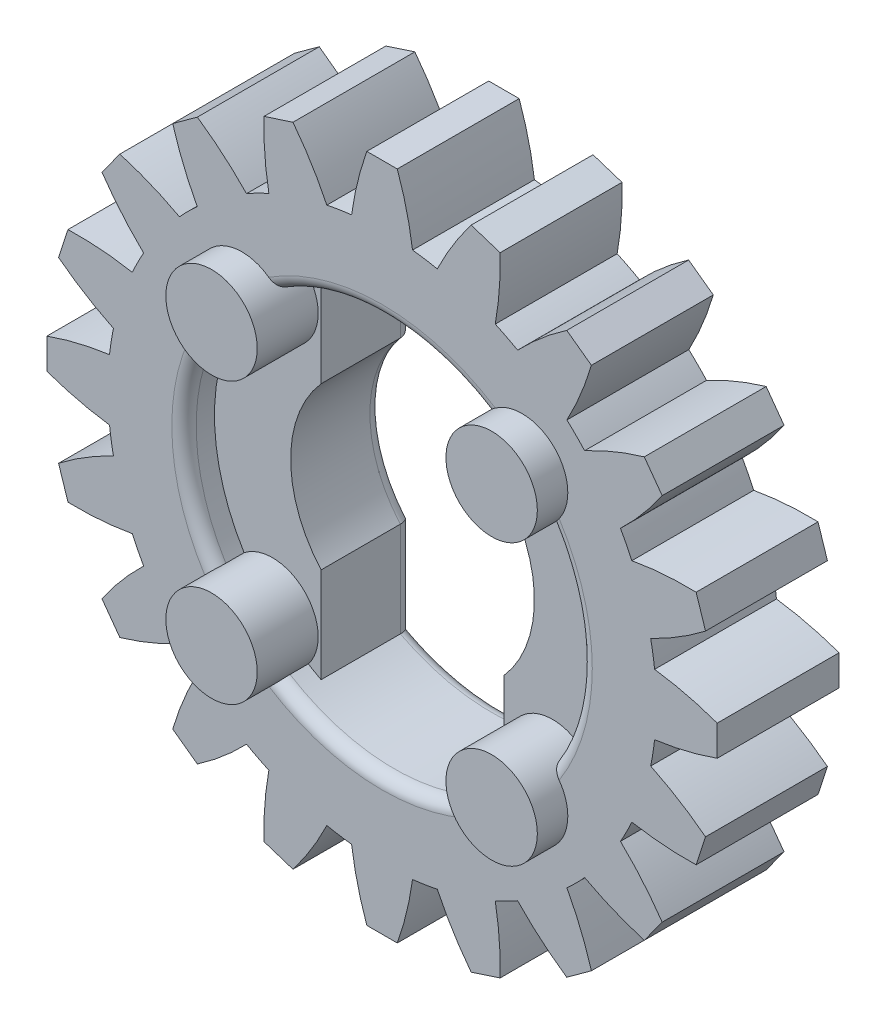
from build123d import *

# Parameters (mm, degrees)
SKETCH_1_R           = 4.500000000000001
EXTRUDE_1_DEPTH      = 2
SKETCH_4_R           = 3.250000000000001
CUT_EXTRUDE_3_DEPTH  = 0.5
CUT_EXTRUDE_1_DEPTH  = 7.670832032063168
EXTRUDE_START        = -2
EXTRUDE_2_DEPTH      = 2
FILLET_1_R           = 0.2
EXTRUDE_3_DEPTH      = 0.5
EXTRUDE_3_DEPTH_BACK = 1
SKETCH_5_R           = 0.7500000000000001
SKETCH_5_R_2         = 0.7500000000001326
SKETCH_5_R_3         = 0.7500000000001795
SKETCH_5_R_4         = 0.750000000000069


with BuildPart() as part:
    # 草图1 → 凸台-拉伸1 (new body)
    with BuildSketch(Plane.XY):
        Circle(SKETCH_1_R)
    extrude(amount=EXTRUDE_1_DEPTH)

    # 草图4 → 切除-拉伸3 (cut)
    with BuildSketch(Plane.XY.offset(2)):
        Circle(SKETCH_4_R)
    extrude(amount=-CUT_EXTRUDE_3_DEPTH, mode=Mode.SUBTRACT)

    # 草图3 → 切除-拉伸1 (cut, through all)
    with BuildSketch(Plane.XY.offset(2)):
        with BuildLine():
            Line((-1.4999999999999991, -1.322875655532296), (-1.4999999999999993, -2.8831406486676996))
            ThreePointArc((-1.4999999999999993, -2.8831406486676996), (9.2e-16, -3.2500000000000004), (1.5000000000000007, -2.883140648667699))
            Line((1.5000000000000007, -2.883140648667699), (1.5000000000000004, -1.3228756555322945))
            ThreePointArc((1.5000000000000004, -1.3228756555322945), (1.9999999999999998, 2.2e-16), (1.5000000000000004, 1.322875655532295))
            Line((1.5000000000000004, 1.322875655532295), (1.5000000000000002, 2.883140648667699))
            ThreePointArc((1.5000000000000002, 2.883140648667699), (2e-16, 3.2500000000000004), (-1.4999999999999998, 2.8831406486676996))
            Line((-1.4999999999999998, 2.8831406486676996), (-1.4999999999999991, 1.3228756555322956))
            ThreePointArc((-1.4999999999999991, 1.3228756555322956), (-1.9999999999999996, 2.4e-16), (-1.4999999999999991, -1.322875655532296))
        make_face()
    extrude(amount=-CUT_EXTRUDE_1_DEPTH, mode=Mode.SUBTRACT)

    # 草图2 → 凸台-拉伸2 (add)
    with BuildSketch(Plane.XY.offset(2).offset(EXTRUDE_START)):
        with BuildLine():
            Line((1.9373575981598865, 5.153556591021841), (1.4618293399884268, 5.308065088217082))
            ThreePointArc((1.4618293399884268, 5.308065088217082), (1.1606520267352467, 4.872399431289981), (0.9064377531025313, 4.407762538947674))
            ThreePointArc((0.9064377531025313, 4.407762538947674), (1.3905764746872666, 4.27975432332819), (1.8574942693976855, 4.098745544572725))
            ThreePointArc((1.8574942693976855, 4.098745544572725), (1.9249373148175617, 4.62406808765027), (1.9373575981598865, 5.153556591021841))
        make_face()
        with BuildLine():
            Line((3.435073136222657, 4.302647155974325), (3.0305646390148726, 4.596539782135326))
            ThreePointArc((3.0305646390148726, 4.596539782135326), (2.6094999008291686, 4.275266028304218), (2.2241470634082, 3.9119266148961294))
            ThreePointArc((2.2241470634082, 3.9119266148961294), (2.6450336353161346, 3.640576474687261), (3.033164057783147, 3.3241413626036542))
            ThreePointArc((3.033164057783147, 3.3241413626036542), (3.2596397989477355, 3.802911743167154), (3.435073136222657, 4.302647155974325))
        make_face()
        with BuildLine():
            Line((4.5965397821500895, 3.030564638994542), (4.3026471559891, 3.4350731362023295))
            ThreePointArc((4.3026471559891, 3.4350731362023295), (3.8029117431750286, 3.259639798938069), (3.324141362603664, 3.033164057783135))
            ThreePointArc((3.324141362603664, 3.033164057783135), (3.6405764746872684, 2.645033635316121), (3.911926614896136, 2.2241470634081852))
            ThreePointArc((3.911926614896136, 2.2241470634081852), (4.2752660283109725, 2.6094999008186957), (4.5965397821500895, 3.030564638994542))
        make_face()
        with BuildLine():
            Line((5.30806508822484, 1.4618293399645328), (5.1535565910296155, 1.9373575981359852))
            ThreePointArc((5.1535565910296155, 1.9373575981359852), (4.624068087654777, 1.9249373148059337), (4.098745544572733, 1.8574942693976708))
            ThreePointArc((4.098745544572733, 1.8574942693976708), (4.279754323328198, 1.3905764746872515), (4.407762538947678, 0.9064377531025155))
            ThreePointArc((4.407762538947678, 0.9064377531025155), (4.87239943129317, 1.160652026723203), (5.30806508822484, 1.4618293399645328))
        make_face()
        with BuildLine():
            Line((0.25000000002511774, 5.499999999999996), (-0.25, 5.500000000000001))
            ThreePointArc((-0.25, 5.500000000000001), (-0.40180855447370334, 4.9925884299380545), (-0.5000000000000003, 4.472135954999579))
            ThreePointArc((-0.5000000000000003, 4.472135954999579), (2.8e-16, 4.499999999999999), (0.5000000000000003, 4.472135954999579))
            ThreePointArc((0.5000000000000003, 4.472135954999579), (0.4018085544861396, 4.9925884299373635), (0.25000000002511774, 5.499999999999996))
        make_face()
        with BuildLine():
            Line((5.499999999999996, -0.2500000000251174), (5.500000000000002, 0.24999999999998082))
            ThreePointArc((5.500000000000002, 0.24999999999998082), (4.9925884299380545, 0.4018085544736856), (4.4721359549995805, 0.49999999999998473))
            ThreePointArc((4.4721359549995805, 0.49999999999998473), (4.499999999999999, -1.567e-14), (4.472135954999577, -0.500000000000016))
            ThreePointArc((4.472135954999577, -0.500000000000016), (4.992588429937362, -0.4018085544861396), (5.499999999999996, -0.2500000000251174))
        make_face()
        with BuildLine():
            Line((5.153556591021841, -1.9373575981598858), (5.308065088217076, -1.4618293399884452))
            ThreePointArc((5.308065088217076, -1.4618293399884452), (4.872399431289976, -1.1606520267352636), (4.4077625389476704, -0.9064377531025464))
            ThreePointArc((4.4077625389476704, -0.9064377531025464), (4.279754323328185, -1.3905764746872815), (4.098745544572718, -1.8574942693976995))
            ThreePointArc((4.098745544572718, -1.8574942693976995), (4.624068087650268, -1.9249373148175613), (5.153556591021841, -1.9373575981598858))
        make_face()
        with BuildLine():
            Line((4.302647155974325, -3.435073136222657), (4.596539782135315, -3.0305646390148873))
            ThreePointArc((4.596539782135315, -3.0305646390148873), (4.275266028304208, -2.6094999008291833), (3.9119266148961214, -2.224147063408212))
            ThreePointArc((3.9119266148961214, -2.224147063408212), (3.640576474687251, -2.645033635316146), (3.324141362603644, -3.033164057783157))
            ThreePointArc((3.324141362603644, -3.033164057783157), (3.8029117431671526, -3.2596397989477346), (4.302647155974325, -3.435073136222657))
        make_face()
        with BuildLine():
            Line((3.0305646389945426, -4.596539782150089), (3.4350731362023152, -4.302647155989114))
            ThreePointArc((3.4350731362023152, -4.302647155989114), (3.259639798938057, -3.8029117431750414), (3.033164057783123, -3.3241413626036764))
            ThreePointArc((3.033164057783123, -3.3241413626036764), (2.6450336353161084, -3.6405764746872795), (2.2241470634081715, -3.911926614896146))
            ThreePointArc((2.2241470634081715, -3.911926614896146), (2.6094999008186957, -4.275266028310971), (3.0305646389945426, -4.596539782150089))
        make_face()
        with BuildLine():
            Line((1.461829339964533, -5.30806508822484), (1.9373575981359654, -5.153556591029619))
            ThreePointArc((1.9373575981359654, -5.153556591029619), (1.9249373148059155, -4.62406808765478), (1.8574942693976553, -4.098745544572736))
            ThreePointArc((1.8574942693976553, -4.098745544572736), (1.3905764746872344, -4.2797543233281985), (0.906437753102499, -4.4077625389476776))
            ThreePointArc((0.906437753102499, -4.4077625389476776), (1.1606520267232003, -4.872399431293165), (1.461829339964533, -5.30806508822484))
        make_face()
        with BuildLine():
            Line((-0.2500000000251171, -5.499999999999996), (0.24999999999996161, -5.500000000000003))
            ThreePointArc((0.24999999999996161, -5.500000000000003), (0.4018085544736687, -4.992588429938055), (0.49999999999996914, -4.472135954999582))
            ThreePointArc((0.49999999999996914, -4.472135954999582), (-3.17e-14, -4.499999999999999), (-0.5000000000000315, -4.472135954999575))
            ThreePointArc((-0.5000000000000315, -4.472135954999575), (-0.4018085544861396, -4.99258842993736), (-0.2500000000251171, -5.499999999999996))
        make_face()
        with BuildLine():
            Line((-1.9373575981598856, -5.153556591021841), (-1.4618293399884648, -5.308065088217073))
            ThreePointArc((-1.4618293399884648, -5.308065088217073), (-1.1606520267352813, -4.872399431289974), (-0.9064377531025627, -4.407762538947667))
            ThreePointArc((-0.9064377531025627, -4.407762538947667), (-1.3905764746872975, -4.279754323328181), (-1.8574942693977148, -4.098745544572712))
            ThreePointArc((-1.8574942693977148, -4.098745544572712), (-1.92493731481756, -4.624068087650267), (-1.9373575981598856, -5.153556591021841))
        make_face()
        with BuildLine():
            Line((-3.4350731362226563, -4.302647155974325), (-3.030564639014905, -4.596539782135302))
            ThreePointArc((-3.030564639014905, -4.596539782135302), (-2.6094999008291992, -4.275266028304197), (-2.224147063408227, -3.911926614896111))
            ThreePointArc((-2.224147063408227, -3.911926614896111), (-2.64503363531616, -3.6405764746872387), (-3.03316405778317, -3.3241413626036302))
            ThreePointArc((-3.03316405778317, -3.3241413626036302), (-3.259639798947733, -3.80291174316715), (-3.4350731362226563, -4.302647155974325))
        make_face()
        with BuildLine():
            Line((-4.596539782150089, -3.0305646389945426), (-4.302647155989127, -3.435073136202298))
            ThreePointArc((-4.302647155989127, -3.435073136202298), (-3.8029117431750534, -3.259639798938042), (-3.3241413626036866, -3.0331640577831105))
            ThreePointArc((-3.3241413626036866, -3.0331640577831105), (-3.640576474687289, -2.6450336353160937), (-3.911926614896153, -2.2241470634081564))
            ThreePointArc((-3.911926614896153, -2.2241470634081564), (-4.275266028310969, -2.6094999008186934), (-4.596539782150089, -3.0305646389945426))
        make_face()
        with BuildLine():
            Line((-5.30806508822484, -1.4618293399645335), (-5.153556591029626, -1.937357598135949))
            ThreePointArc((-5.153556591029626, -1.937357598135949), (-4.624068087654786, -1.9249373148059021), (-4.0987455445727425, -1.857494269397642))
            ThreePointArc((-4.0987455445727425, -1.857494269397642), (-4.279754323328205, -1.390576474687222), (-4.407762538947682, -0.9064377531024846))
            ThreePointArc((-4.407762538947682, -0.9064377531024846), (-4.872399431293164, -1.1606520267232003), (-5.30806508822484, -1.4618293399645335))
        make_face()
        with BuildLine():
            Line((-5.499999999999996, 0.2500000000251167), (-5.5000000000000036, -0.24999999999994238))
            ThreePointArc((-5.5000000000000036, -0.24999999999994238), (-4.992588429938057, -0.40180855447365094), (-4.472135954999584, -0.4999999999999535))
            ThreePointArc((-4.472135954999584, -0.4999999999999535), (-4.499999999999999, 4.851e-14), (-4.472135954999573, 0.5000000000000472))
            ThreePointArc((-4.472135954999573, 0.5000000000000472), (-4.992588429937358, 0.4018085544861396), (-5.499999999999996, 0.2500000000251167))
        make_face()
        with BuildLine():
            Line((-5.153556591021841, 1.9373575981598852), (-5.308065088217067, 1.461829339988483))
            ThreePointArc((-5.308065088217067, 1.461829339988483), (-4.87239943128997, 1.160652026735299), (-4.407762538947663, 0.9064377531025779))
            ThreePointArc((-4.407762538947663, 0.9064377531025779), (-4.279754323328175, 1.3905764746873115), (-4.098745544572705, 1.8574942693977285))
            ThreePointArc((-4.098745544572705, 1.8574942693977285), (-4.624068087650265, 1.92493731481756), (-5.153556591021841, 1.9373575981598852))
        make_face()
        with BuildLine():
            Line((-4.302647155974325, 3.435073136222656), (-4.5965397821352925, 3.0305646390149215))
            ThreePointArc((-4.5965397821352925, 3.0305646390149215), (-4.2752660283041894, 2.609499900829215), (-3.911926614896104, 2.2241470634082416))
            ThreePointArc((-3.911926614896104, 2.2241470634082416), (-3.6405764746872316, 2.645033635316173), (-3.324141362603621, 3.0331640577831824))
            ThreePointArc((-3.324141362603621, 3.0331640577831824), (-3.802911743167148, 3.25963979894773), (-4.302647155974325, 3.435073136222656))
        make_face()
        with BuildLine():
            Line((-3.0305646389945435, 4.596539782150089), (-3.435073136202283, 4.302647155989138))
            ThreePointArc((-3.435073136202283, 4.302647155989138), (-3.2596397989380286, 3.8029117431750654), (-3.033164057783098, 3.3241413626036973))
            ThreePointArc((-3.033164057783098, 3.3241413626036973), (-2.6450336353160795, 3.640576474687298), (-2.224147063408142, 3.9119266148961604))
            ThreePointArc((-2.224147063408142, 3.9119266148961604), (-2.609499900818692, 4.275266028310968), (-3.0305646389945435, 4.596539782150089))
        make_face()
        with BuildLine():
            Line((-1.4618293399645335, 5.30806508822484), (-1.9373575981359321, 5.153556591029633))
            ThreePointArc((-1.9373575981359321, 5.153556591029633), (-1.924937314805887, 4.624068087654794), (-1.8574942693976282, 4.09874554457275))
            ThreePointArc((-1.8574942693976282, 4.09874554457275), (-1.3905764746872078, 4.279754323328208), (-0.9064377531024701, 4.407762538947685))
            ThreePointArc((-0.9064377531024701, 4.407762538947685), (-1.1606520267231994, 4.872399431293163), (-1.4618293399645335, 5.30806508822484))
        make_face()
    extrude(amount=EXTRUDE_2_DEPTH)

    # 圆角1
    fillet_1_edges = [part.edges().sort_by_distance(p)[0] for p in [
        (1.9999999999999998, 1.1e-16, 0),
        (1.5000000000000004, -2.1030081520999966, 0),
        (2.8e-16, -3.2500000000000004, 0),
        (-1.4999999999999993, -2.103008152099998, 0),
        (-1.9999999999999996, -2.2e-16, 0),
        (-1.4999999999999993, 2.103008152099998, 0),
        (8.3e-16, 3.250000000000001, 0),
        (1.5000000000000002, 2.103008152099997, 0),
        (-3.250000000000007, 4.95e-15, 2),
    ]]
    fillet(fillet_1_edges, radius=FILLET_1_R)

    # 草图5 → 凸台-拉伸3 (add, two sides: drawn at the far end of the back side and taken through both)
    with BuildSketch(Plane.XY.offset(2).offset(-EXTRUDE_3_DEPTH_BACK)):
        with Locations((-2.2980970388562927, 2.2980970388562665)):
            Circle(SKETCH_5_R)
        with Locations((2.298097038856267, 2.2980970388564206)):
            Circle(SKETCH_5_R_2)
        with Locations((2.2980970388564215, -2.2980970388561386)):
            Circle(SKETCH_5_R_3)
        with Locations((-2.298097038856138, -2.2980970388562936)):
            Circle(SKETCH_5_R_4)
    extrude(amount=EXTRUDE_3_DEPTH + EXTRUDE_3_DEPTH_BACK)


solid = part.part
